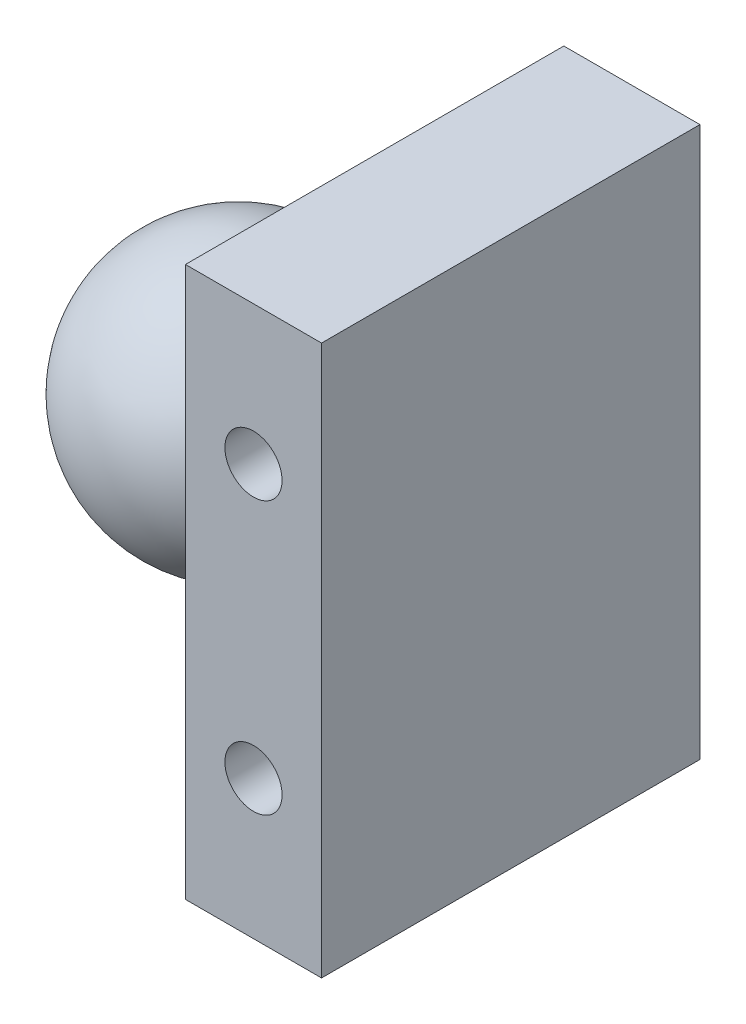
from build123d import *

# Parameters (mm, degrees)
ESQUISSE1_W             = 5
ESQUISSE1_H             = 20.2
BOSS_EXTRU_1_DEPTH      = 13.9
ESQUISSE4_R             = 1.05
ENL_V_MAT_EXTRU_1_DEPTH = 18.362891464
SKETCH1_R               = 3
BOSS_EXTRUDE1_DEPTH     = 1


with BuildPart() as part:
    # Esquisse1 → Boss.-Extru.1 (new body)
    with BuildSketch(Plane.XY):
        Rectangle(ESQUISSE1_W, ESQUISSE1_H)
    extrude(amount=BOSS_EXTRU_1_DEPTH)

    # Esquisse4 → Enlèv. mat.-Extru.1 (cut, through all)
    with BuildSketch(Plane(origin=(0, 0, 0), x_dir=(-1, 0, 0), z_dir=(0, 0, -1))):
        with Locations((0, 5)):
            Circle(ESQUISSE4_R)
        with Locations((0, -5)):
            Circle(ESQUISSE4_R)
    extrude(amount=-ENL_V_MAT_EXTRU_1_DEPTH, mode=Mode.SUBTRACT)

    # Sketch1 → Boss-Extrude1 (add)
    with BuildSketch(Plane.ZY.offset(2.5)):
        with Locations(Location((6.95, 0, 0), (0, 0, 270))):
            Circle(SKETCH1_R)
    extrude(amount=BOSS_EXTRUDE1_DEPTH)

    # Sketch5 → Revolve4 (revolve)
    with BuildSketch(Plane(origin=(0, 0, 0), x_dir=(-1, 0, 0), z_dir=(0, -1, 0))):
        with BuildLine():
            Line((3.5, -6.95), (12.5, -6.95))
            ThreePointArc((12.5, -6.95), (9.08113883, -11.69341649), (3.5, -9.95))
            Line((3.5, -9.95), (3.5, -6.95))
        make_face()
    revolve(axis=Axis((-3.5, 0, 6.95), (-1, 0, 0)))


solid = part.part
